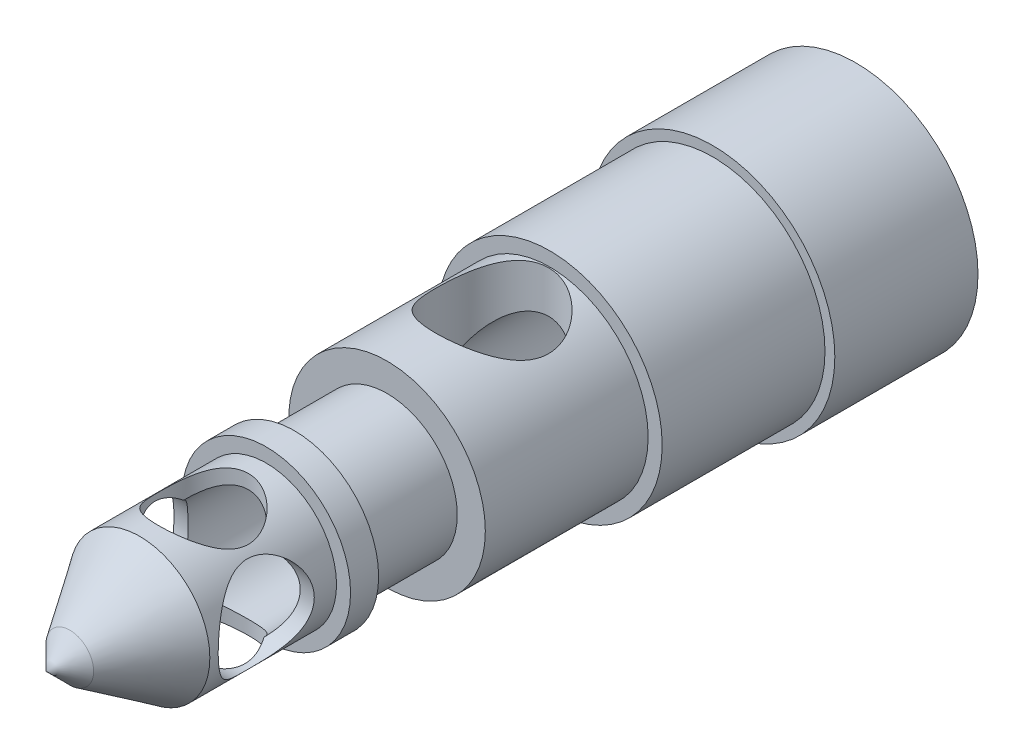
from build123d import *

# Parameters (mm, degrees)
ESQUISSE1_R                  = 2.175
BOSS_EXTRU_1_DEPTH           = 2.55
ESQUISSE2_R                  = 2
BOSS_EXTRU_2_DEPTH           = 2.9
ESQUISSE3_R                  = 1.75
BOSS_EXTRU_3_DEPTH           = 2.9
ESQUISSE4_R                  = 1.25
BOSS_EXTRU_4_DEPTH           = 1.65
ESQUISSE6_R                  = 1.5
BOSS_EXTRU_5_DEPTH           = 0.5
ESQUISSE7_R                  = 1.25
BOSS_EXTRU_6_DEPTH           = 1
ENL_V_MAT_EXTRU_1_DEPTH      = 15.749083129
ENL_V_MAT_EXTRU_1_DEPTH_BACK = 15.749083129
ESQUISSE9_R                  = 1.007367239
ENL_V_MAT_EXTRU_3_DEPTH      = 15.749083129
ENL_V_MAT_EXTRU_3_DEPTH_BACK = 15.749083129
ESQUISSE10_R                 = 0.802442124
ENL_V_MAT_EXTRU_4_DEPTH      = 15.749083129
ENL_V_MAT_EXTRU_4_DEPTH_BACK = 15.749083129
ESQUISSE11_R                 = 0.855382824
ESQUISSE12_R                 = 1
ENL_V_MAT_EXTRU_5_DEPTH      = 12.5


with BuildPart() as part:
    # Esquisse1 → Boss.-Extru.1 (new body)
    with BuildSketch(Plane.XY):
        Circle(ESQUISSE1_R)
    extrude(amount=BOSS_EXTRU_1_DEPTH)

    # Esquisse2 → Boss.-Extru.2 (add)
    with BuildSketch(Plane.XY.offset(2.55)):
        Circle(ESQUISSE2_R)
    extrude(amount=BOSS_EXTRU_2_DEPTH)

    # Esquisse3 → Boss.-Extru.3 (add)
    with BuildSketch(Plane.XY.offset(5.45)):
        Circle(ESQUISSE3_R)
    extrude(amount=BOSS_EXTRU_3_DEPTH)

    # Esquisse4 → Boss.-Extru.4 (add)
    with BuildSketch(Plane.XY.offset(8.35)):
        Circle(ESQUISSE4_R)
    extrude(amount=BOSS_EXTRU_4_DEPTH)

    # Esquisse6 → Boss.-Extru.5 (add)
    with BuildSketch(Plane.XY.offset(10)):
        Circle(ESQUISSE6_R)
    extrude(amount=BOSS_EXTRU_5_DEPTH)

    # Esquisse7 → Boss.-Extru.6 (add)
    with BuildSketch(Plane.XY.offset(10.5)):
        Circle(ESQUISSE7_R)
    extrude(amount=BOSS_EXTRU_6_DEPTH)

    # Esquisse8 → Révolution1 (revolve)
    with BuildSketch(Plane(origin=(0, 0, 0), x_dir=(0, 0, -1), z_dir=(1, 0, 0)), mode=Mode.PRIVATE) as r_volution1_sk:
        Polygon((-11.5, 1.25), (-11.5, 0), (-14.424777404, 0), (-14.000366252, 0.424411153), (-13.473350205, 0.774200564), (-12.756479055, 1.25), align=None)
    revolve(r_volution1_sk.sketch.rotate(Axis((0, 0, 14.424777404), (0, 0, -1)), 90), axis=Axis((0, 0, 14.424777404), (0, 0, -1)))

    # Esquisse9 → Enlèv. mat.-Extru.1 (cut, two sides: drawn at the far end of the back side and taken through both)
    with BuildSketch(Plane(origin=(0, 0, 0), x_dir=(1, 0, 0), z_dir=(0, 1, 0)).offset(-ENL_V_MAT_EXTRU_1_DEPTH_BACK)):
        with Locations(Location((0, -6.479875752, 0), (0, 0, 270))):
            Circle(ESQUISSE9_R)
    extrude(amount=ENL_V_MAT_EXTRU_1_DEPTH + ENL_V_MAT_EXTRU_1_DEPTH_BACK, mode=Mode.SUBTRACT)

    # Esquisse10 → Enlèv. mat.-Extru.3 (cut, two sides: drawn at the far end of the back side and taken through both)
    with BuildSketch(Plane(origin=(0, 0, 0), x_dir=(1, 0, 0), z_dir=(0, 1, 0)).offset(-ENL_V_MAT_EXTRU_3_DEPTH_BACK)):
        with Locations(Location((0, -11.621319279, 0), (0, 0, 270))):
            Circle(ESQUISSE10_R)
    extrude(amount=ENL_V_MAT_EXTRU_3_DEPTH + ENL_V_MAT_EXTRU_3_DEPTH_BACK, mode=Mode.SUBTRACT)

    # Esquisse11 → Enlèv. mat.-Extru.4 (cut, two sides: drawn at the far end of the back side and taken through both)
    with BuildSketch(Plane(origin=(0, 0, 0), x_dir=(0, 0, -1), z_dir=(1, 0, 0)).offset(-ENL_V_MAT_EXTRU_4_DEPTH_BACK)):
        with Locations(Location((-11.751997158, 0, 0), (0, 0, 180.000000002))):
            Circle(ESQUISSE11_R)
    extrude(amount=ENL_V_MAT_EXTRU_4_DEPTH + ENL_V_MAT_EXTRU_4_DEPTH_BACK, mode=Mode.SUBTRACT)

    # Esquisse12 → Enlèv. mat.-Extru.5 (cut)
    with BuildSketch(Plane(origin=(0, 0, 0), x_dir=(-1, 0, 0), z_dir=(0, 0, -1))):
        with Locations(Location((0, 0, 0), (0, 0, 315.693451476))):
            Circle(ESQUISSE12_R)
    extrude(amount=-ENL_V_MAT_EXTRU_5_DEPTH, mode=Mode.SUBTRACT)


solid = part.part
